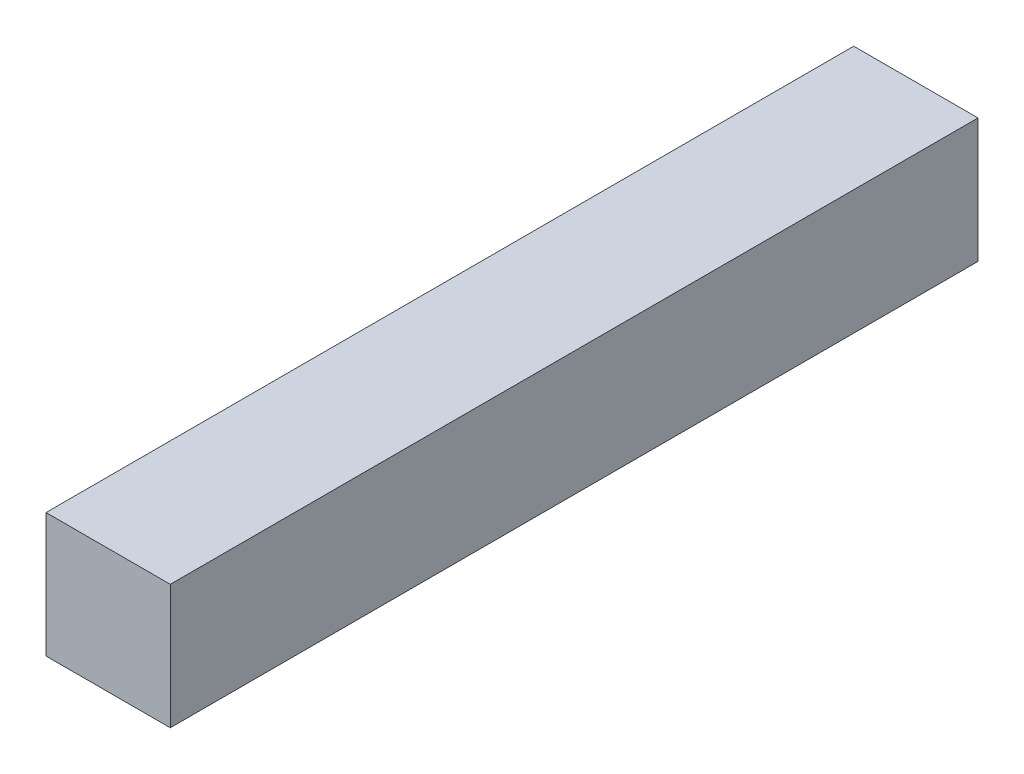
from build123d import *

# Parameters (mm, degrees)
SKETCH_1_W      = 20
SKETCH_1_H      = 20
EXTRUDE_1_DEPTH = 130


with BuildPart() as part:
    # Эскиз1 → Бобышка-Вытянуть1 (new body)
    with BuildSketch(Plane.XY):
        Rectangle(SKETCH_1_W, SKETCH_1_H)
    extrude(amount=EXTRUDE_1_DEPTH)


solid = part.part
